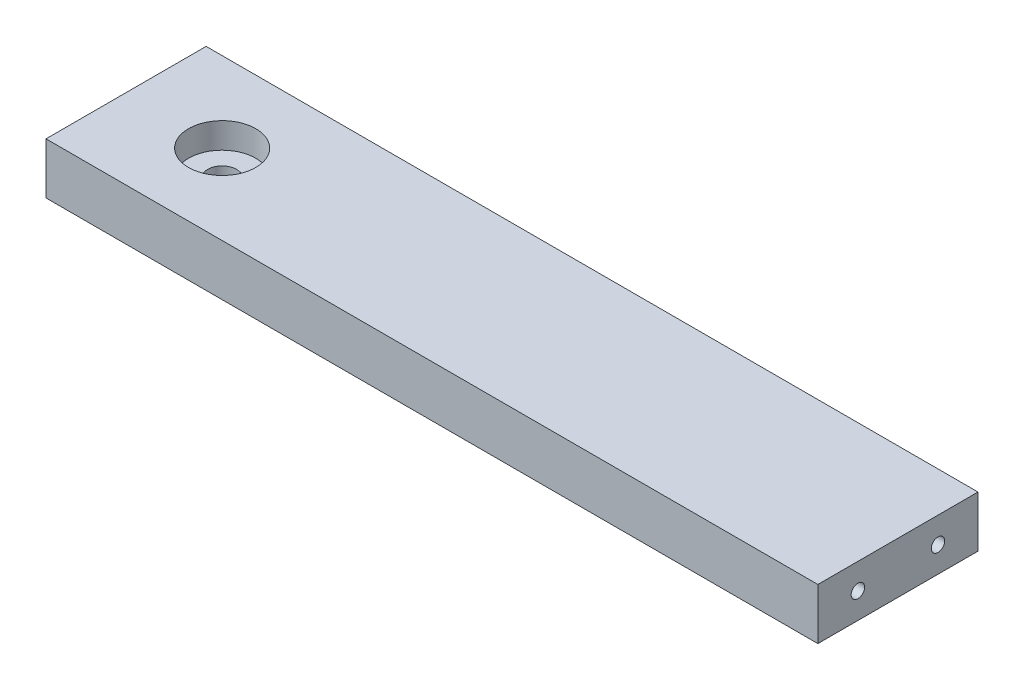
from build123d import *

# Parameters (mm, degrees)
SKETCH2_W             = 241
SKETCH2_H             = 50
BOSS_EXTRUDE1_DEPTH   = 16
SKETCH3_R             = 10.5
CUT_EXTRUDE1_DEPTH    = 8
SKETCH6_R             = 4.5
CUT_EXTRUDE2_DEPTH    = 124.325788057
M5_TAPPED_HOLE4_D     = 4.2
M5_TAPPED_HOLE4_DEPTH = 22.4
M5_TAPPED_HOLE4_TIP   = 1.2618073


with BuildPart() as part:
    # Sketch2 → Boss-Extrude1 (new body)
    with BuildSketch(Plane(origin=(0, 0, 0), x_dir=(1, 0, 0), z_dir=(0, 1, 0))):
        Rectangle(SKETCH2_W, SKETCH2_H)
    extrude(amount=BOSS_EXTRUDE1_DEPTH)

    # Sketch3 → Cut-Extrude1 (cut)
    with BuildSketch(Plane(origin=(0, 16, 0), x_dir=(1, 0, 0), z_dir=(0, 1, 0))):
        with Locations(Location((-90.5, 0, 0), (0, 0, 270))):
            Circle(SKETCH3_R)
    extrude(amount=-CUT_EXTRUDE1_DEPTH, mode=Mode.SUBTRACT)

    # Sketch6 → Cut-Extrude2 (cut, through all)
    with BuildSketch(Plane(origin=(0, 8, 0), x_dir=(1, 0, 0), z_dir=(0, 1, 0))):
        with Locations(Location((-90.5, 0, 0), (0, 0, 270))):
            Circle(SKETCH6_R)
    extrude(amount=-CUT_EXTRUDE2_DEPTH, mode=Mode.SUBTRACT)

    # M5 Tapped Hole4
    with Locations(Plane(origin=(120.5, 0, 0), x_dir=(0, 0, -1), z_dir=(1, 0, 0))):
        with Locations((-12.5, 8), (12.5, 8)):
            Hole(M5_TAPPED_HOLE4_D / 2, depth=M5_TAPPED_HOLE4_DEPTH)
            with Locations((0, 0, -(M5_TAPPED_HOLE4_DEPTH + M5_TAPPED_HOLE4_TIP / 2))):  # 118° drill point
                Cone(0, M5_TAPPED_HOLE4_D / 2, M5_TAPPED_HOLE4_TIP, mode=Mode.SUBTRACT)


solid = part.part
